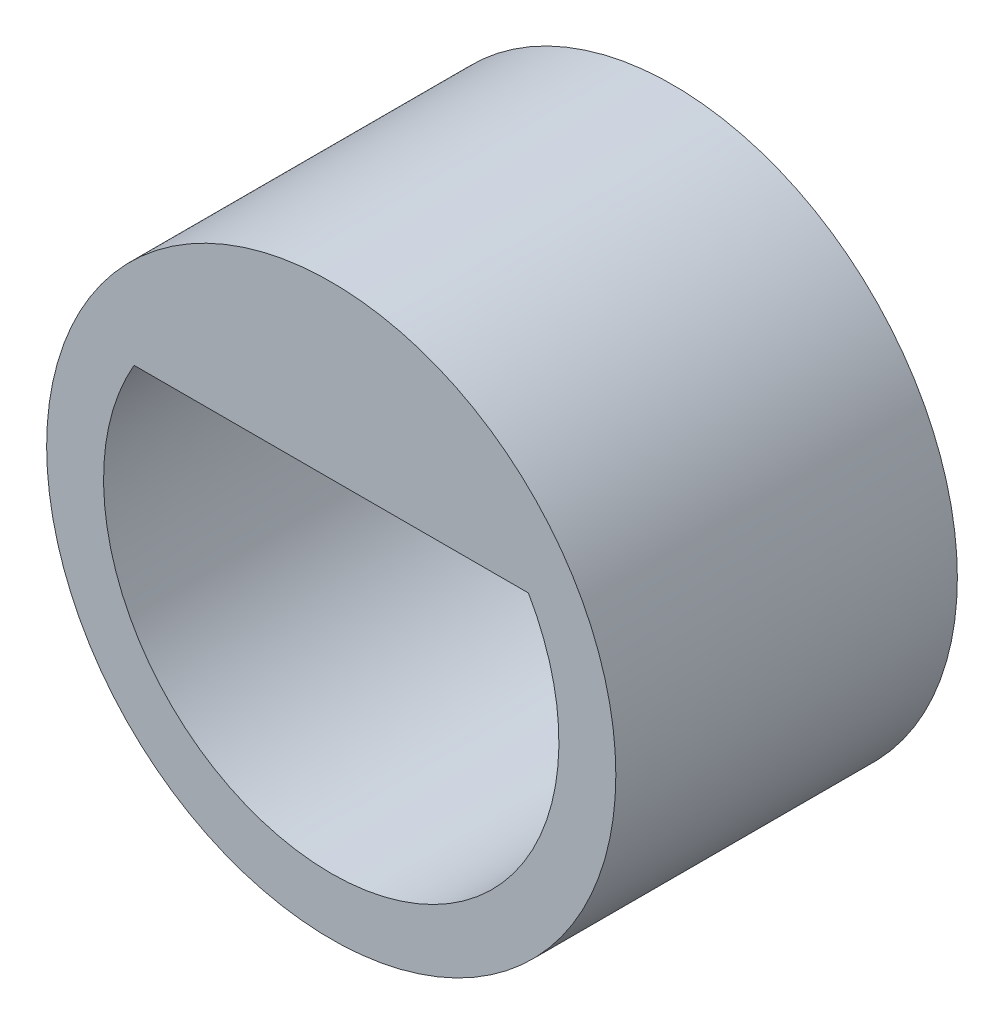
from build123d import *

# Parameters (mm, degrees)
SKETCH_1_R      = 2.5
EXTRUDE_1_DEPTH = 3


with BuildPart() as part:
    # 草图1 → 凸台-拉伸1 (new body)
    with BuildSketch(Plane.XY):
        Circle(SKETCH_1_R)
        with BuildLine():
            ThreePointArc((1.732050808, 1), (0, -2), (-1.732050808, 1))
            Line((-1.732050808, 1), (1.732050808, 1))
        make_face(mode=Mode.SUBTRACT)
    extrude(amount=EXTRUDE_1_DEPTH)


solid = part.part
